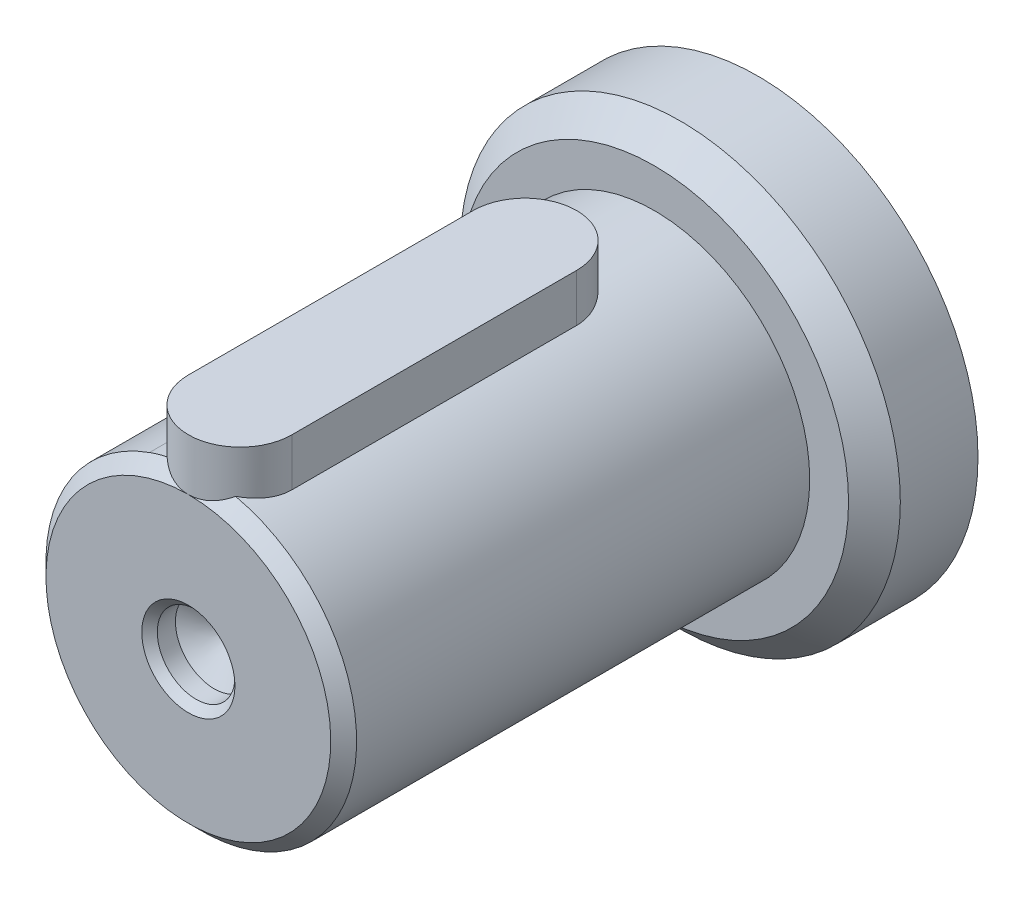
from build123d import *

# Parameters (mm, degrees)
ESQUISSE1_R                    = 8.5
BOSS_EXTRU_1_DEPTH             = 4
ESQUISSE2_R                    = 6
BOSS_EXTRU_2_DEPTH             = 18
CHANFREIN1_SIZE                = 1
CHANFREIN2_SIZE                = 0.5
BOSS_EXTRU_3_DEPTH             = 1.5
BOSS_EXTRU_3_DEPTH_BACK        = 1
TROUS_DE_CENTRAGE_3_0MM1_D     = 3
TROUS_DE_CENTRAGE_3_0MM1_DEPTH = 1
TROUS_DE_CENTRAGE_3_0MM1_TIP   = 0.901290929
CHANFREIN3_SIZE                = 0.3


with BuildPart() as part:
    # Esquisse1 → Boss.-Extru.1 (new body)
    with BuildSketch(Plane.XY):
        Circle(ESQUISSE1_R)
    extrude(amount=BOSS_EXTRU_1_DEPTH)

    # Esquisse2 → Boss.-Extru.2 (add)
    with BuildSketch(Plane.XY.offset(4)):
        Circle(ESQUISSE2_R)
    extrude(amount=BOSS_EXTRU_2_DEPTH)

    # Chanfrein1
    chanfrein1_edges = [part.edges().sort_by_distance(p)[0] for p in [
        (-8.5, 0, 4),
    ]]
    chamfer(chanfrein1_edges, length=CHANFREIN1_SIZE)

    # Chanfrein2
    chanfrein2_edges = [part.edges().sort_by_distance(p)[0] for p in [
        (-6, 0, 22),
    ]]
    chamfer(chanfrein2_edges, length=CHANFREIN2_SIZE)

    # Esquisse3 → Boss.-Extru.3 (add, two sides: drawn at the far end of the back side and taken through both)
    with BuildSketch(Plane(origin=(0, 6, 0), x_dir=(1, 0, 0), z_dir=(0, 1, 0)).offset(-BOSS_EXTRU_3_DEPTH_BACK)):
        with BuildLine():
            Line((-2, -20), (-2, -9))
            ThreePointArc((-2, -9), (0, -7), (2, -9))
            Line((2, -9), (2, -20))
            ThreePointArc((2, -20), (0, -22), (-2, -20))
        make_face()
    extrude(amount=BOSS_EXTRU_3_DEPTH + BOSS_EXTRU_3_DEPTH_BACK)

    # Trous de centrage Ø3.0mm1
    with Locations(Plane.XY.offset(22)):
        with Locations((0, 0)):
            Hole(TROUS_DE_CENTRAGE_3_0MM1_D / 2, depth=TROUS_DE_CENTRAGE_3_0MM1_DEPTH)
            with Locations((0, 0, -(TROUS_DE_CENTRAGE_3_0MM1_DEPTH + TROUS_DE_CENTRAGE_3_0MM1_TIP / 2))):  # 118° drill point
                Cone(0, TROUS_DE_CENTRAGE_3_0MM1_D / 2, TROUS_DE_CENTRAGE_3_0MM1_TIP, mode=Mode.SUBTRACT)

    # Chanfrein3
    chanfrein3_edges = [part.edges().sort_by_distance(p)[0] for p in [
        (1.5, 0, 22),
    ]]
    chamfer(chanfrein3_edges, length=CHANFREIN3_SIZE)


solid = part.part
